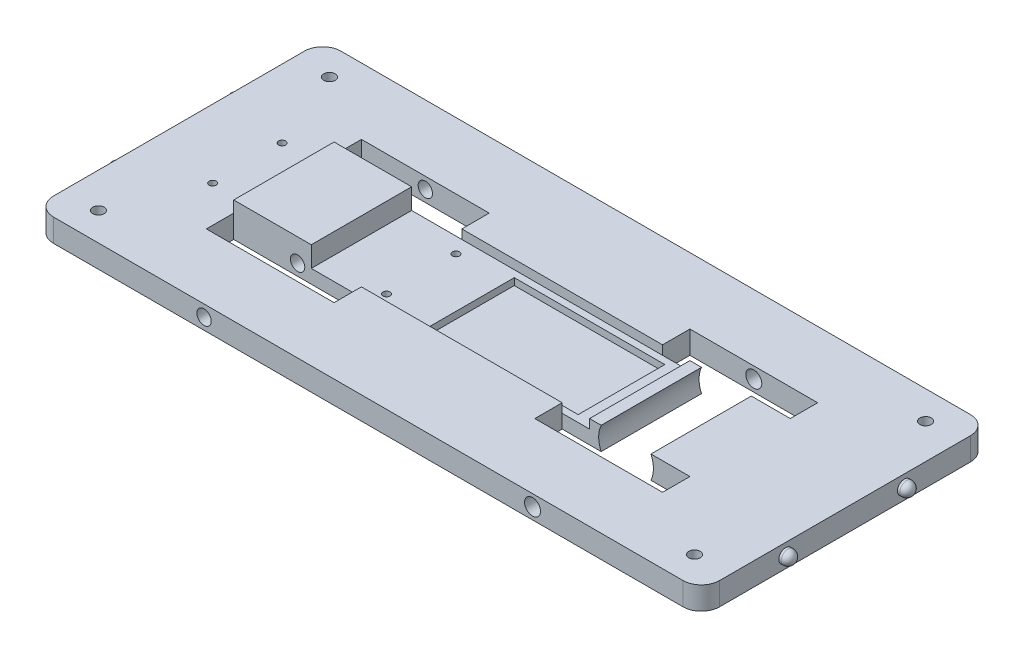
from build123d import *

# Parameters (mm, degrees)
SKETCH1_W               = 138
SKETCH1_H               = 63
BOSS_EXTRUDE1_DEPTH     = 2.5
SKETCH3_W               = 28
SKETCH3_H               = 6
CUT_EXTRUDE2_DEPTH      = 10
SKETCH4_W               = 61
SKETCH4_H               = 22
CUT_EXTRUDE3_DEPTH      = 2
SKETCH6_W               = 33
SKETCH6_H               = 19
CUT_EXTRUDE5_DEPTH      = 1.5
SKETCH11_R              = 0.775
CUT_EXTRUDE8_DEPTH      = 6
CUT_EXTRUDE9_DEPTH      = 82.077123777
CUT_EXTRUDE9_DEPTH_BACK = 82.077123777
SKETCH5_R               = 1.575
SKETCH5_R_2             = 1.75
SKETCH16_R              = 6
CUT_EXTRUDE10_DEPTH     = 11
SKETCH19_R              = 1.25
CUT_EXTRUDE12_DEPTH     = 5
SKETCH21_W              = 17
SKETCH21_H              = 2.5
BOSS_EXTRUDE2_DEPTH     = 11
SKETCH22_W              = 63
SKETCH22_H              = 5
BOSS_EXTRUDE3_DEPTH     = 4
SKETCH23_R              = 1.5
BOSS_EXTRUDE4_DEPTH     = 2
FILLET3_R               = 4
FILLET2_R               = 1.5


with BuildPart() as part:
    # Sketch1 → Boss-Extrude1 (new, symmetric)
    with BuildSketch(Plane(origin=(0, 0, 0), x_dir=(1, 0, 0), z_dir=(0, 1, 0))):
        Rectangle(SKETCH1_W, SKETCH1_H)
    extrude(amount=BOSS_EXTRUDE1_DEPTH, both=True)

    # Sketch3 → Cut-Extrude2 (cut)
    with BuildSketch(Plane(origin=(0, 2.5, 0), x_dir=(1, 0, 0), z_dir=(0, 1, 0))):
        with Locations((-36, -14)):
            Rectangle(SKETCH3_W, SKETCH3_H)
        with Locations((36, -14)):
            Rectangle(SKETCH3_W, SKETCH3_H)
        with Locations((36, 14)):
            Rectangle(SKETCH3_W, SKETCH3_H)
        with Locations((-36, 14)):
            Rectangle(SKETCH3_W, SKETCH3_H)
    extrude(amount=-CUT_EXTRUDE2_DEPTH, mode=Mode.SUBTRACT)

    # Sketch4 → Cut-Extrude3 (cut)
    with BuildSketch(Plane(origin=(0, 2.5, 0), x_dir=(1, 0, 0), z_dir=(0, 1, 0))):
        with Locations((-2.5, 0)):
            Rectangle(SKETCH4_W, SKETCH4_H)
    extrude(amount=-CUT_EXTRUDE3_DEPTH, mode=Mode.SUBTRACT)

    # Sketch6 → Cut-Extrude5 (cut)
    with BuildSketch(Plane(origin=(0, 0.5, 0), x_dir=(1, 0, 0), z_dir=(0, 1, 0))):
        with Locations((7.5, 0)):
            Rectangle(SKETCH6_W, SKETCH6_H)
    extrude(amount=-CUT_EXTRUDE5_DEPTH, mode=Mode.SUBTRACT)

    # Sketch11 → Cut-Extrude8 (cut)
    with BuildSketch(Plane(origin=(0, 2.5, 0), x_dir=(1, 0, 0), z_dir=(0, 1, 0))):
        with Locations(Location((-58, 7.62, 0), (0, 0, 270))):
            Circle(SKETCH11_R)
        with Locations(Location((-19.9, 7.62, 0), (0, 0, 270))):
            Circle(SKETCH11_R)
        with Locations(Location((-58, -7.62, 0), (0, 0, 270))):
            Circle(SKETCH11_R)
        with Locations(Location((-19.9, -7.62, 0), (0, 0, 270))):
            Circle(SKETCH11_R)
    extrude(amount=-CUT_EXTRUDE8_DEPTH, mode=Mode.SUBTRACT)

    # Sketch5 → Cut-Extrude9 (cut, two sides: drawn at the far end of the back side and taken through both)
    with BuildSketch(Plane(origin=(0, 0, -11), x_dir=(-1, 0, 0), z_dir=(0, 0, -1)).offset(-CUT_EXTRUDE9_DEPTH_BACK)):
        with Locations((36, 0)):
            Circle(SKETCH5_R)
        with Locations((-36, 0)):
            Circle(SKETCH5_R_2)
    extrude(amount=CUT_EXTRUDE9_DEPTH + CUT_EXTRUDE9_DEPTH_BACK, mode=Mode.SUBTRACT)

    # Sketch16 → Cut-Extrude10 (cut, symmetric)
    with BuildSketch(Plane.XY):
        with Locations((36, 0)):
            Circle(SKETCH16_R)
    extrude(amount=CUT_EXTRUDE10_DEPTH, both=True, mode=Mode.SUBTRACT)

    # Sketch19 → Cut-Extrude12 (cut)
    with BuildSketch(Plane(origin=(0, 2.5, 0), x_dir=(1, 0, 0), z_dir=(0, 1, 0))):
        with Locations(Location((-65.33, 25.32, 0), (0, 0, 270))):
            Circle(SKETCH19_R)
        with Locations(Location((-65.33, -25.32, 0), (0, 0, 90))):
            Circle(SKETCH19_R)
        with Locations(Location((65.33, -25.32, 0), (0, 0, 270))):
            Circle(SKETCH19_R)
        with Locations(Location((65.33, 25.32, 0), (0, 0, 90))):
            Circle(SKETCH19_R)
    extrude(amount=-CUT_EXTRUDE12_DEPTH, mode=Mode.SUBTRACT)

    # Sketch21 → Boss-Extrude2 (add, symmetric)
    with BuildSketch(Plane.XY):
        with Locations((-41.5, 3.75)):
            Rectangle(SKETCH21_W, SKETCH21_H)
    extrude(amount=BOSS_EXTRUDE2_DEPTH, both=True)

    # Sketch22 → Boss-Extrude3 (add)
    with BuildSketch(Plane(origin=(69, 0, 0), x_dir=(0, 0, -1), z_dir=(1, 0, 0))):
        Rectangle(SKETCH22_W, SKETCH22_H)
    boss_extrude3 = extrude(amount=BOSS_EXTRUDE3_DEPTH)

    # Sketch23 → Boss-Extrude4 (add)
    with BuildSketch(Plane(origin=(73, 0, 0), x_dir=(0, 0, -1), z_dir=(1, 0, 0))):
        with Locations((-13, 0)):
            Circle(SKETCH23_R)
        with Locations((13, 0)):
            Circle(SKETCH23_R)
    boss_extrude4 = extrude(amount=BOSS_EXTRUDE4_DEPTH)

    # Mirror1: Boss-Extrude3 across plane
    add(boss_extrude3.mirror(Plane(origin=(0, 0, 0), x_dir=(0, 0, 1), z_dir=(1, 0, 0))))

    # Mirror7: Boss-Extrude4 across plane
    add(boss_extrude4.mirror(Plane(origin=(0, 0, 0), x_dir=(0, 0, 1), z_dir=(1, 0, 0))))

    # Fillet3
    fillet3_edges = [part.edges().sort_by_distance(p)[0] for p in [
        (73, 0, 31.5),
        (73, 0, -31.5),
        (-73, 0, 31.5),
        (-73, 0, -31.5),
    ]]
    fillet(fillet3_edges, radius=FILLET3_R)

    # Fillet2
    fillet2_edges = [part.edges().sort_by_distance(p)[0] for p in [
        (75, 0, 14.5),
        (75, 0, -11.5),
        (-75, 0, 14.5),
        (-75, 0, -11.5),
    ]]
    fillet(fillet2_edges, radius=FILLET2_R)


solid = part.part
